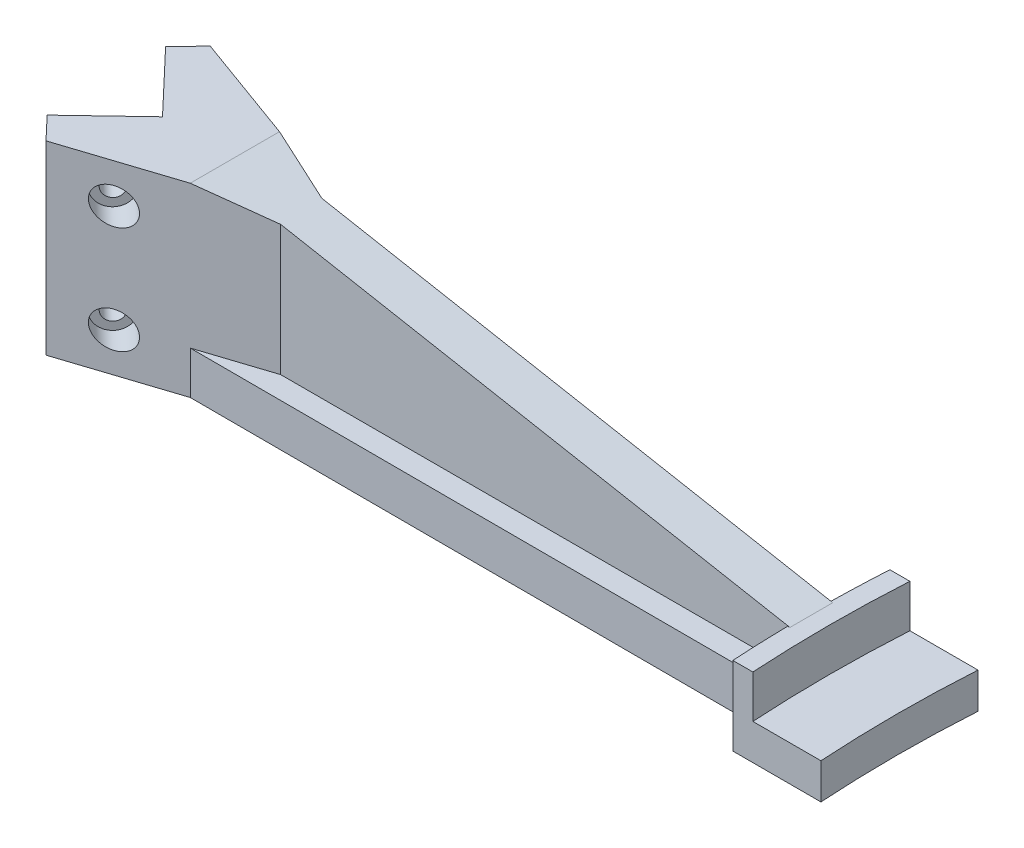
from build123d import *

# Parameters (mm, degrees)
BOSS_EXTRUDE2_DEPTH          = 12
BOSS_EXTRUDE3_START          = -2
BOSS_EXTRUDE3_DEPTH          = 10
BOSS_EXTRUDE4_START          = 10
BOSS_EXTRUDE4_DEPTH          = 22
BOSS_EXTRUDE7_DEPTH          = 40
BOSS_EXTRUDE17_DEPTH         = 6
BOSS_EXTRUDE17_DEPTH_BACK    = 6
CUT_EXTRUDE_THIN1_DEPTH      = 204.107832617
CUT_EXTRUDE_THIN1_DEPTH_BACK = 204.107832617
CUT_EXTRUDE1_START           = -8
SKETCH6_R                    = 5
CUT_EXTRUDE1_DEPTH           = 163.861994657
SKETCH6_4_R                  = 2.75
CUT_EXTRUDE2_DEPTH           = 171.861994657


with BuildPart() as part:
    # Sketch2 → Boss-Extrude2 (new body)
    with BuildSketch(Plane(origin=(0, 0, 0), x_dir=(1, 0, 0), z_dir=(0, 1, 0))):
        with BuildLine():
            Line((-197.696610314, 15.743442535), (-181.12456554, 0))
            Line((-181.12456554, 0), (-197.696610314, -17.444257657))
            Line((-197.696610314, -17.444257657), (-191.610767905, -23.850407561))
            Line((-191.610767905, -23.850407561), (-161.12456554, -12.777855375))
            Line((-161.12456554, -12.777855375), (0.21086679, -12.5))
            ThreePointArc((0.21086679, -12.5), (0.401744327, -17.25142014), (0.653571446, -22))
            Line((0.653571446, -22), (6.263616969, -22))
            ThreePointArc((6.263616969, -22), (5.6, 0), (6.263616969, 22))
            Line((6.263616969, 22), (0.653571446, 22))
            ThreePointArc((0.653571446, 22), (0.401744327, 17.25142014), (0.21086679, 12.5))
            Line((0.21086679, 12.5), (-161.12456554, 12.222144625))
            Line((-161.12456554, 12.222144625), (-191.610767905, 22.149592439))
            Line((-191.610767905, 22.149592439), (-197.696610314, 15.743442535))
        make_face()
    extrude(amount=-BOSS_EXTRUDE2_DEPTH)

    # Sketch2<5> → Boss-Extrude3 (add)
    with BuildSketch(Plane(origin=(0, 0, 0), x_dir=(1, 0, 0), z_dir=(0, 1, 0)).offset(BOSS_EXTRUDE3_START)):
        with BuildLine():
            Line((25.340211435, 22), (6.263616969, 22))
            ThreePointArc((6.263616969, 22), (5.6, 0), (6.263616969, -22))
            Line((6.263616969, -22), (25.340211435, -22))
            ThreePointArc((25.340211435, -22), (24.64, 0), (25.340211435, 22))
        make_face()
    extrude(amount=-BOSS_EXTRUDE3_DEPTH)

    # Sketch2<6> → Boss-Extrude4 (add)
    with BuildSketch(Plane(origin=(0, 0, 0), x_dir=(1, 0, 0), z_dir=(0, 1, 0)).offset(BOSS_EXTRUDE4_START)):
        with BuildLine():
            ThreePointArc((0.653571446, 22), (0.401744327, 17.25142014), (0.21086679, 12.5))
            ThreePointArc((0.21086679, 12.5), (0, 0), (0.21086679, -12.5))
            ThreePointArc((0.21086679, -12.5), (0.401744327, -17.25142014), (0.653571446, -22))
            Line((0.653571446, -22), (6.263616969, -22))
            ThreePointArc((6.263616969, -22), (5.6, 0), (6.263616969, 22))
            Line((6.263616969, 22), (0.653571446, 22))
        make_face()
    extrude(amount=-BOSS_EXTRUDE4_DEPTH)

    # Sketch2<9> → Boss-Extrude7 (add)
    with BuildSketch(Plane(origin=(0, 0, 0), x_dir=(1, 0, 0), z_dir=(0, 1, 0))):
        Polygon((-197.696610314, 15.743442535), (-181.12456554, 0), (-197.696610314, -17.444257657), (-191.610767905, -23.850407561), (-124.831467486, 0.40375437), (-191.610767905, 22.149592439), align=None)
    extrude(amount=BOSS_EXTRUDE7_DEPTH)

    # Sketch4 → Boss-Extrude17 (add, two sides: drawn at the far end of the back side and taken through both)
    with BuildSketch(Plane.XY.offset(-BOSS_EXTRUDE17_DEPTH_BACK)):
        Polygon((0.653571446, 10), (-161.12456554, 40), (-161.12456554, 0), (0.653571446, 0), align=None)
    extrude(amount=BOSS_EXTRUDE17_DEPTH + BOSS_EXTRUDE17_DEPTH_BACK)

    # Sketch5 → Cut-Extrude-Thin1 (cut, two sides: drawn at the far end of the back side and taken through both)
    with BuildSketch(Plane.XY.offset(-CUT_EXTRUDE_THIN1_DEPTH_BACK)):
        Polygon((0.653571446, 10), (-161.12456554, 40), (-159.301258723, 49.832372666), (2.476878263, 19.832372666), align=None)
    extrude(amount=CUT_EXTRUDE_THIN1_DEPTH + CUT_EXTRUDE_THIN1_DEPTH_BACK, mode=Mode.SUBTRACT)

    # Sketch6 → Cut-Extrude1 (cut, through all)
    with BuildSketch(Plane(origin=(-95.203451007, 0, -90.443278456), x_dir=(-0.6887494619146907, 0, 0.724999433594416), z_dir=(-0.724999433594416, 0, -0.6887494619146907)).offset(CUT_EXTRUDE1_START)):
        with Locations((134.749447055, 29)):
            Circle(SKETCH6_R)
        with Locations((134.749447055, -1)):
            Circle(SKETCH6_R)
    cut_extrude1 = extrude(amount=-CUT_EXTRUDE1_DEPTH, mode=Mode.SUBTRACT)

    # Sketch6<4> → Cut-Extrude2 (cut, symmetric)
    with BuildSketch(Plane(origin=(-95.203451007, 0, -90.443278456), x_dir=(-0.6887494619146907, 0, 0.724999433594416), z_dir=(-0.724999433594416, 0, -0.6887494619146907))):
        with Locations((134.749447055, 29)):
            Circle(SKETCH6_4_R)
        with Locations((134.749447055, -1)):
            Circle(SKETCH6_4_R)
    cut_extrude2 = extrude(amount=CUT_EXTRUDE2_DEPTH, both=True, mode=Mode.SUBTRACT)

    # Mirror1: Cut-Extrude1, Cut-Extrude2 across plane
    add(cut_extrude1.mirror(Plane.XY), mode=Mode.SUBTRACT)
    add(cut_extrude2.mirror(Plane.XY), mode=Mode.SUBTRACT)


with BuildPart() as body_2:
    # Mirror3: mirrored copy
    add(part.part.mirror(Plane.XY))


solid = body_2.part
